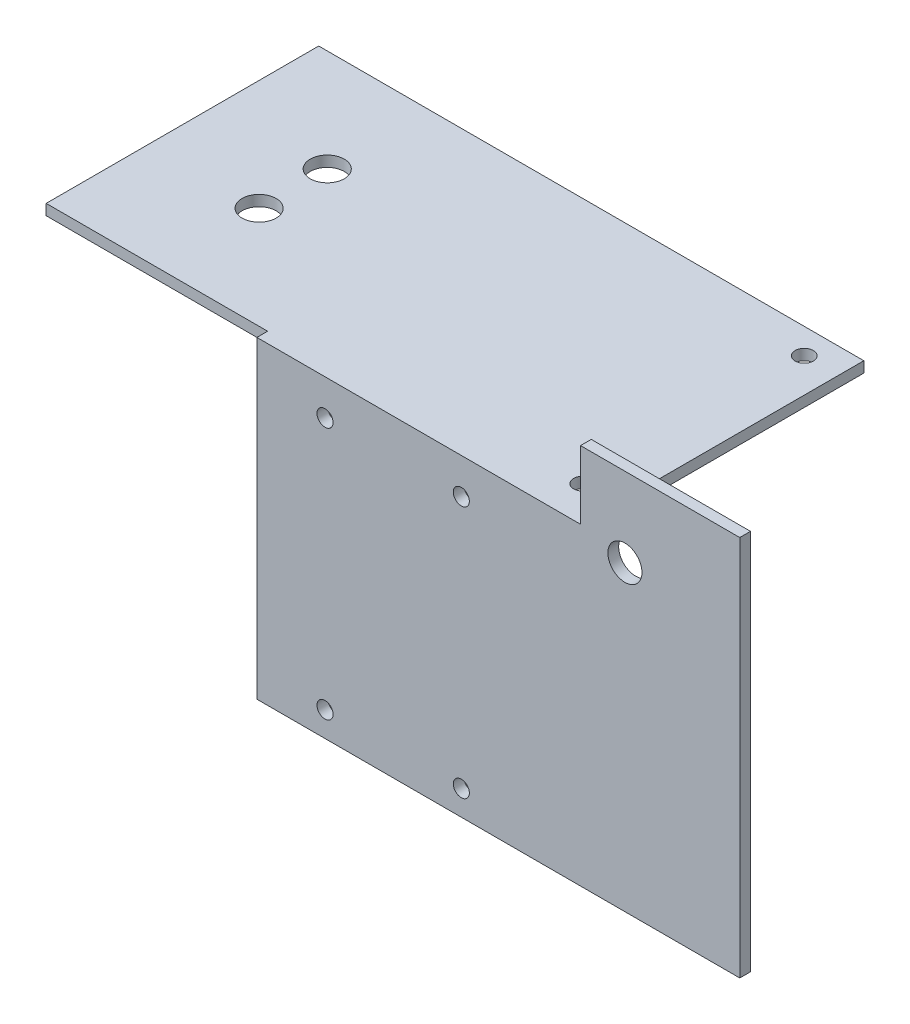
from build123d import *

# Parameters (mm, degrees)
SKETCH1_R           = 3.175
SKETCH1_R_2         = 1.5
BOSS_EXTRUDE1_DEPTH = 2
BOSS_EXTRUDE2_DEPTH = 50.8
SKETCH3_R           = 1.7
SKETCH3_R_2         = 3.175
CUT_EXTRUDE1_DEPTH  = 120.575917308


with BuildPart() as part:
    # Sketch1 → Boss-Extrude1 (new body)
    with BuildSketch(Plane.XY):
        Polygon((0, 58.4), (60.325, 58.4), (60.325, 71.1), (90, 71.1), (90, 0), (0, 0), align=None)
        with Locations((68.6, 56.33204182)):
            Circle(SKETCH1_R, mode=Mode.SUBTRACT)
        with Locations((12.7, 51.75)):
            Circle(SKETCH1_R_2, mode=Mode.SUBTRACT)
        with Locations((38.1, 51.75)):
            Circle(SKETCH1_R_2, mode=Mode.SUBTRACT)
        with Locations((12.7, 4.65)):
            Circle(SKETCH1_R_2, mode=Mode.SUBTRACT)
        with Locations((38.1, 4.65)):
            Circle(SKETCH1_R_2, mode=Mode.SUBTRACT)
    extrude(amount=-BOSS_EXTRUDE1_DEPTH)

    # Sketch2 → Boss-Extrude2 (add)
    with BuildSketch(Plane(origin=(0, 0, -2), x_dir=(-1, 0, 0), z_dir=(0, 0, -1))):
        Polygon((0, 56.4), (41.275, 56.4), (41.275, 58.4), (0, 58.4), (-60.325, 58.4), (-60.325, 56.4), align=None)
    extrude(amount=BOSS_EXTRUDE2_DEPTH)

    # Sketch3 → Cut-Extrude1 (cut, through all)
    with BuildSketch(Plane(origin=(0, 58.4, 0), x_dir=(1, 0, 0), z_dir=(0, 1, 0))):
        with Locations(Location((53.975, 48.0375, 0), (0, 0, 270))):
            Circle(SKETCH3_R)
        with Locations(Location((53.975, 6.7625, 0), (0, 0, 270))):
            Circle(SKETCH3_R)
        with Locations(Location((-20.6375, 33.75, 0), (0, 0, 270))):
            Circle(SKETCH3_R_2)
        with Locations(Location((-20.6375, 21.05, 0), (0, 0, 270))):
            Circle(SKETCH3_R_2)
    extrude(amount=-CUT_EXTRUDE1_DEPTH, mode=Mode.SUBTRACT)


solid = part.part
